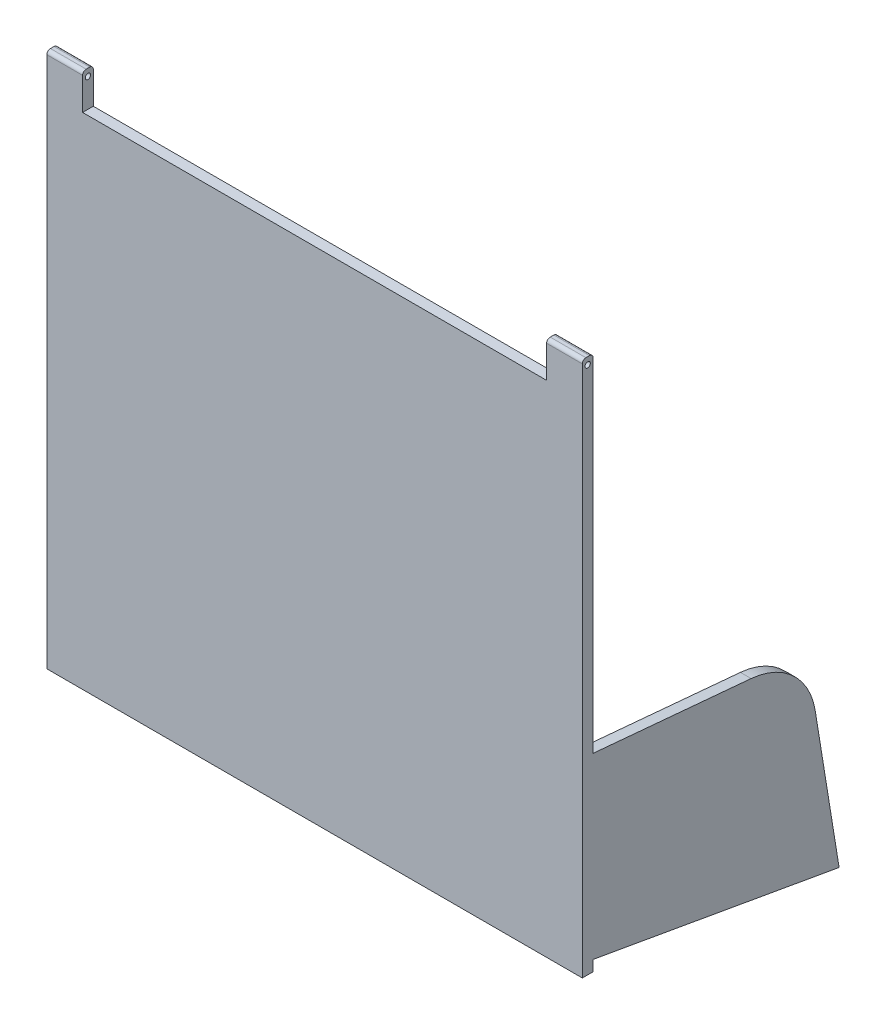
from build123d import *

# Parameters (mm, degrees)
ESQUISSE1_W                  = 150
ESQUISSE1_H                  = 150
BOSS_EXTRU_1_DEPTH           = 3
ESQUISSE3_W                  = 130
ESQUISSE3_H                  = 10
ENL_V_MAT_EXTRU_1_DEPTH      = 3
ENL_V_MAT_EXTRU_2_DEPTH      = 153
ENL_V_MAT_EXTRU_2_DEPTH_BACK = 200
ESQUISSE4_R                  = 0.75
CONG_1_R                     = 1
BOSS_EXTRU_5_DEPTH           = 3
BOSS_EXTRU_6_DEPTH           = 3
CONG_4_R                     = 20


with BuildPart() as part:
    # Esquisse1 → Boss.-Extru.1 (new body)
    with BuildSketch(Plane.XY):
        with Locations((75, 75)):
            Rectangle(ESQUISSE1_W, ESQUISSE1_H)
    extrude(amount=BOSS_EXTRU_1_DEPTH)

    # Esquisse3 → Enlèv. mat.-Extru.1 (cut)
    with BuildSketch(Plane.XY.offset(3)):
        with Locations((75, 145)):
            Rectangle(ESQUISSE3_W, ESQUISSE3_H)
    extrude(amount=-ENL_V_MAT_EXTRU_1_DEPTH, mode=Mode.SUBTRACT)

    # Esquisse4 → Enlèv. mat.-Extru.2 (cut, two sides: drawn at the far end of the back side and taken through both)
    with BuildSketch(Plane(origin=(10, 0, 0), x_dir=(0, 0, -1), z_dir=(1, 0, 0)).offset(-ENL_V_MAT_EXTRU_2_DEPTH_BACK)):
        with Locations(Location((-1.5, 148, 0), (0, 0, 270))):
            Circle(ESQUISSE4_R)
    extrude(amount=ENL_V_MAT_EXTRU_2_DEPTH + ENL_V_MAT_EXTRU_2_DEPTH_BACK, mode=Mode.SUBTRACT)

    # Congé1
    cong_1_edges = [part.edges().sort_by_distance(p)[0] for p in [
        (145, 150, 3),
        (5, 150, 0),
        (5, 150, 3),
        (145, 150, 0),
    ]]
    fillet(cong_1_edges, radius=CONG_1_R)

    # Esquisse8 → Boss.-Extru.5 (add)
    with BuildSketch(Plane(origin=(150, 0, 0), x_dir=(0, 0, -1), z_dir=(1, 0, 0))):
        Polygon((0, 3), (68.936542711, -9.155372437), (59.757502948, 47.611044498), (0, 53), align=None)
    extrude(amount=-BOSS_EXTRU_5_DEPTH)

    # Esquisse9 → Boss.-Extru.6 (add)
    with BuildSketch(Plane.ZY):
        Polygon((0, 53), (-59.757502948, 47.611044498), (-68.936542711, -9.155372437), (0, 3), align=None)
    extrude(amount=-BOSS_EXTRU_6_DEPTH)

    # Congé4
    cong_4_edges = [part.edges().sort_by_distance(p)[0] for p in [
        (148.5, 47.611044498, -59.757502948),
        (1.5, 47.611044498, -59.757502948),
    ]]
    fillet(cong_4_edges, radius=CONG_4_R)


solid = part.part
